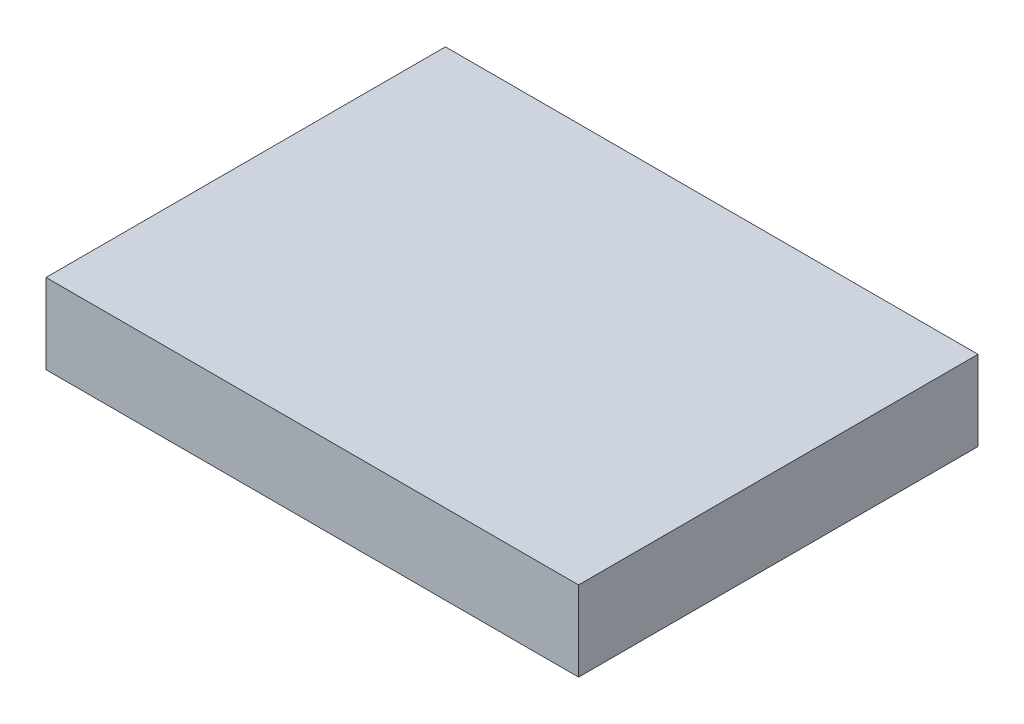
from build123d import *

# Parameters (mm, degrees)
SKETCH1_W           = 50.8
SKETCH1_H           = 38.1
BOSS_EXTRUDE1_DEPTH = 7.62


with BuildPart() as part:
    # Sketch1 → Boss-Extrude1 (new body)
    with BuildSketch(Plane(origin=(0, 0, 0), x_dir=(1, 0, 0), z_dir=(0, 1, 0))):
        with Locations((25.4, 19.05)):
            Rectangle(SKETCH1_W, SKETCH1_H)
    extrude(amount=BOSS_EXTRUDE1_DEPTH)


solid = part.part
